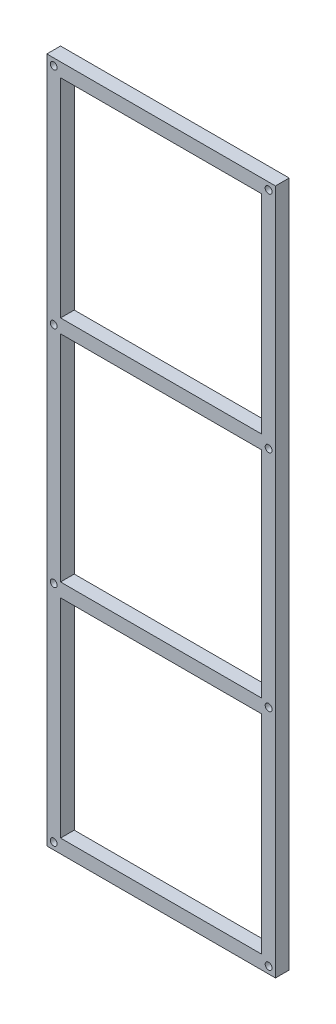
from build123d import *

# Parameters (mm, degrees)
SKETCH1_W           = 100
SKETCH1_H           = 300
SKETCH1_W_2         = 88
SKETCH1_H_2         = 91
SKETCH1_H_3         = 94
BOSS_EXTRUDE1_DEPTH = 6
SKETCH2_R           = 1.5
CUT_EXTRUDE1_DEPTH  = 6


with BuildPart() as part:
    # Sketch1 → Boss-Extrude1 (new body)
    with BuildSketch(Plane.XY):
        Rectangle(SKETCH1_W, SKETCH1_H)
        with Locations((0, 98.5)):
            Rectangle(SKETCH1_W_2, SKETCH1_H_2, mode=Mode.SUBTRACT)
        with Locations((0, -98.5)):
            Rectangle(SKETCH1_W_2, SKETCH1_H_2, mode=Mode.SUBTRACT)
        Rectangle(SKETCH1_W_2, SKETCH1_H_3, mode=Mode.SUBTRACT)
    extrude(amount=BOSS_EXTRUDE1_DEPTH)

    # Sketch2 → Cut-Extrude1 (cut)
    with BuildSketch(Plane.XY.offset(6)):
        with Locations((-47, 147)):
            Circle(SKETCH2_R)
        with Locations((47, 147)):
            Circle(SKETCH2_R)
        with Locations((47, 49)):
            Circle(SKETCH2_R)
        with Locations((47, -49)):
            Circle(SKETCH2_R)
        with Locations((47, -147)):
            Circle(SKETCH2_R)
        with Locations((-47, 49)):
            Circle(SKETCH2_R)
        with Locations((-47, -49)):
            Circle(SKETCH2_R)
        with Locations((-47, -147)):
            Circle(SKETCH2_R)
    extrude(amount=-CUT_EXTRUDE1_DEPTH, mode=Mode.SUBTRACT)


solid = part.part
